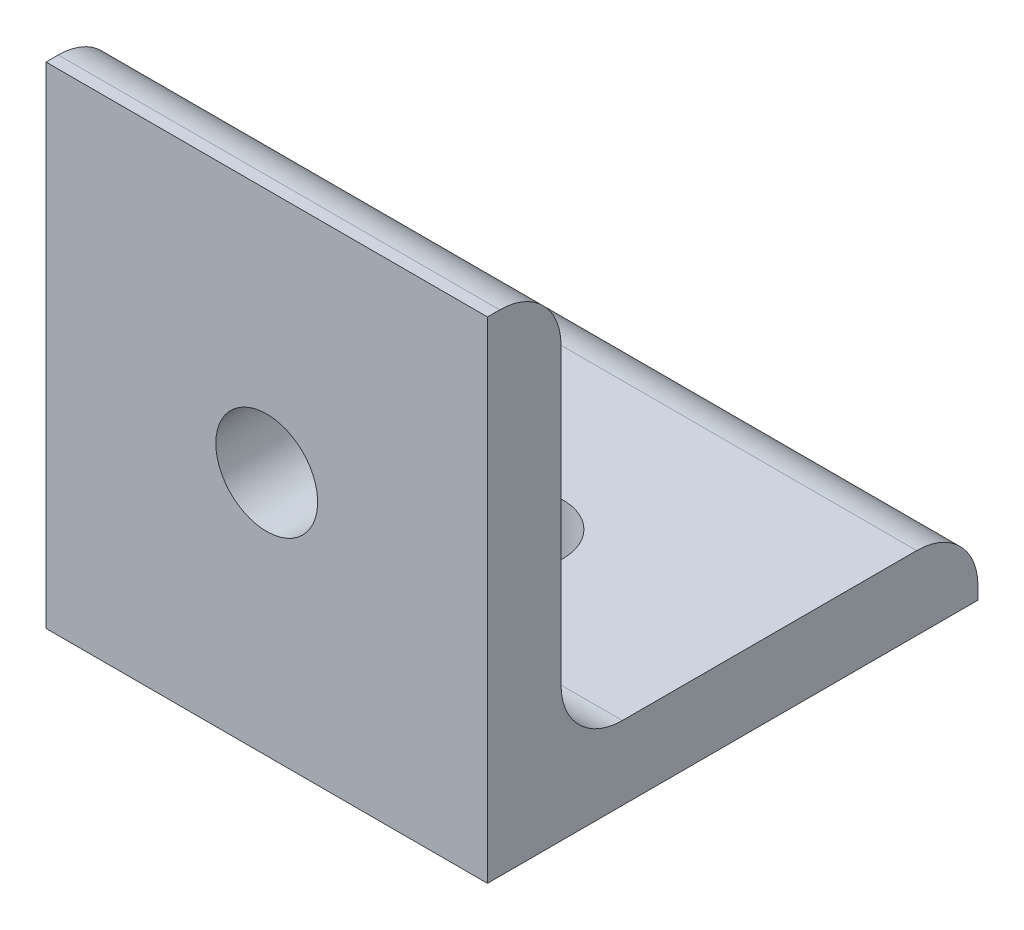
from build123d import *

# Parameters (mm, degrees)
BOSS_EXTRUDE1_DEPTH = 18
SKETCH2_R           = 4.15
CUT_EXTRUDE1_DEPTH  = 56.497747702
SKETCH3_R           = 4.15
CUT_EXTRUDE2_DEPTH  = 56.497747702
FILLET1_R           = 5


with BuildPart() as part:
    # Sketch1 → Boss-Extrude1 (new, symmetric)
    with BuildSketch(Plane(origin=(0, 0, 0), x_dir=(0, 0, -1), z_dir=(1, 0, 0))):
        Polygon((0, 40), (0, 0), (40, 0), (40, 6), (6, 6), (6, 40), align=None)
    extrude(amount=BOSS_EXTRUDE1_DEPTH, both=True)

    # Sketch2 → Cut-Extrude1 (cut, through all)
    with BuildSketch(Plane(origin=(0, 6, 0), x_dir=(1, 0, 0), z_dir=(0, 1, 0))):
        with Locations(Location((0, 20, 0), (0, 0, 270))):
            Circle(SKETCH2_R)
    extrude(amount=-CUT_EXTRUDE1_DEPTH, mode=Mode.SUBTRACT)

    # Sketch3 → Cut-Extrude2 (cut, through all)
    with BuildSketch(Plane(origin=(0, 0, -6), x_dir=(-1, 0, 0), z_dir=(0, 0, -1))):
        with Locations((0, 20)):
            Circle(SKETCH3_R)
    extrude(amount=-CUT_EXTRUDE2_DEPTH, mode=Mode.SUBTRACT)

    # Fillet1
    fillet1_edges = [part.edges().sort_by_distance(p)[0] for p in [
        (0, 40, -6),
        (0, 6, -6),
        (0, 6, -40),
    ]]
    fillet(fillet1_edges, radius=FILLET1_R)


solid = part.part
